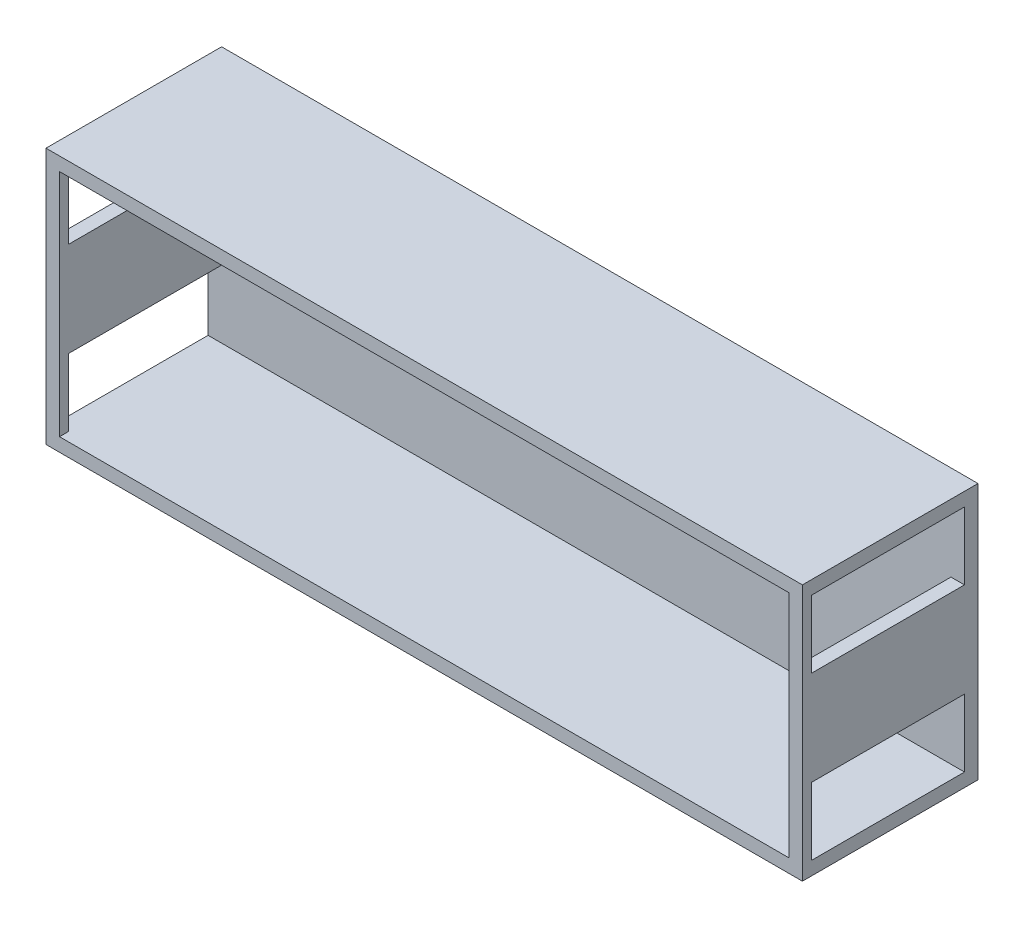
from build123d import *

# Parameters (mm, degrees)
SKETCH1_W           = 112
SKETCH1_H           = 38
BOSS_EXTRUDE1_DEPTH = 26
SHELL1_T            = -2
CUT_EXTRUDE1_DEPTH  = 1
SKETCH5_W           = 22.652499907
SKETCH5_H           = 10
CUT_EXTRUDE2_DEPTH  = 122.09500414
SKETCH6_R           = 1.5
CUT_EXTRUDE3_DEPTH  = 10


with BuildPart() as part:
    # Sketch1 → Boss-Extrude1 (new body)
    with BuildSketch(Plane.XY):
        with Locations((56, 19)):
            Rectangle(SKETCH1_W, SKETCH1_H)
    extrude(amount=BOSS_EXTRUDE1_DEPTH)

    # Shell1
    shell1_openings = [part.faces().sort_by_distance(p)[0] for p in [
        (56, 19, 26),
    ]]
    offset(amount=SHELL1_T, openings=shell1_openings, kind=Kind.INTERSECTION)

    # Sketch4 → Cut-Extrude1 (cut)
    # profile 1 of 8: a face of its own
    with BuildSketch(Plane.XZ):
        with BuildLine():
            add(Edge.make_bspline(
                [(7.650412266, 15.288091295), (7.58962305, 15.288027952), (7.470441275, 15.287903763), (7.295133908, 15.283417738), (7.126224621, 15.278936587), (6.964177459, 15.267429724), (6.808265094, 15.255788808), (6.659070989, 15.239634041), (6.516304896, 15.219523698), (6.380137163, 15.196749021), (6.250194784, 15.171262045), (6.127037021, 15.141896535), (6.010295193, 15.109234566), (5.8997942, 15.07459062), (5.796142209, 15.035264488), (5.698584225, 14.993778932), (5.608240355, 14.947860098), (5.496931644, 14.883918998), (5.371061502, 14.792494742), (5.236991325, 14.666417522), (5.127532685, 14.519509159), (5.036903395, 14.356750097), (4.967312846, 14.176767364), (4.920492006, 13.978901144), (4.892406671, 13.764481263), (4.891236718, 13.615585667), (4.890632732, 13.538718515)],
                knots=[0, 0, 0, 0, 1.163776932, 2.281671148, 3.357400293, 4.398214247, 5.391432629, 6.35063689, 7.270633997, 8.151375154, 8.993571714, 9.805342045, 10.574618554, 11.314185751, 12.021548457, 12.696290651, 13.342801888, 13.96059852, 15.152511344, 16.312453312, 17.470182576, 18.644806038, 19.869798433, 21.151486241, 22.529458571, 24, 24, 24, 24], degree=3))
            Line((4.890632732, 13.538718515), (4.891487848, 12.406898322))
            add(Edge.make_bspline(
                [(4.891487848, 12.406898322), (4.891694054, 12.330706015), (4.892092687, 12.18341258), (4.920844625, 11.971054949), (4.966807258, 11.775119354), (5.037733652, 11.596999755), (5.126848578, 11.434964436), (5.237699287, 11.289724769), (5.370960738, 11.16366211), (5.496960154, 11.072365564), (5.608208387, 11.008309855), (5.698818664, 10.962677467), (5.795894884, 10.9197799), (5.899810758, 10.880707103), (6.010453722, 10.846309606), (6.126859435, 10.812123653), (6.250221556, 10.783170308), (6.380129027, 10.757552155), (6.516309187, 10.73484697), (6.659061948, 10.71458921), (6.808324675, 10.698979528), (6.964078386, 10.68518287), (7.126298655, 10.676180173), (7.295100471, 10.669535163), (7.470256996, 10.665370067), (7.589247441, 10.665948497), (7.649846216, 10.666243076)],
                knots=[0, 0, 0, 0, 1.461116279, 2.824600596, 4.103749251, 5.314955656, 6.49267372, 7.643763169, 8.806761061, 10.001814036, 10.621238284, 11.269452785, 11.948407875, 12.657634162, 13.399149785, 14.172110185, 14.986019164, 15.830434532, 16.713496044, 17.635916927, 18.597648258, 19.593985991, 20.637168773, 21.715955473, 22.836794836, 24, 24, 24, 24], degree=3))
            Line((7.649846216, 10.666243076), (11.641207291, 10.666243076))
            add(Edge.make_bspline(
                [(11.641207291, 10.666243076), (11.688947383, 10.666304114), (11.781543412, 10.666422502), (11.916486689, 10.676044615), (12.042624809, 10.69317153), (12.160690428, 10.716187156), (12.269323443, 10.749014058), (12.369508728, 10.787637785), (12.46141843, 10.833578649), (12.544094165, 10.887857853), (12.619159072, 10.949733512), (12.681970332, 11.023656267), (12.736953332, 11.105620986), (12.780564817, 11.198234478), (12.814756871, 11.299822633), (12.839509693, 11.410801348), (12.853340204, 11.53170153), (12.855775747, 11.615451459), (12.857040757, 11.65895079)],
                knots=[0, 0, 0, 0, 1.267187071, 2.457818685, 3.588295928, 4.645513128, 5.647536173, 6.596988635, 7.493518143, 8.369595162, 9.218359999, 10.066204857, 10.935248591, 11.831896794, 12.774825794, 13.776140545, 14.844937542, 16, 16, 16, 16], degree=3))
            Line((12.857040757, 11.65895079), (12.857991609, 13.205280958))
            add(Edge.make_bspline(
                [(12.857991609, 13.205280958), (12.85669765, 13.220392688), (12.854228646, 13.249227392), (12.84085112, 13.289970659), (12.817015477, 13.324491074), (12.783340828, 13.352536177), (12.740765803, 13.37436985), (12.68905103, 13.389068008), (12.628969951, 13.398663695), (12.585826108, 13.399379023), (12.562940389, 13.39975847)],
                knots=[0, 0, 0, 0, 0.91086014, 1.738013083, 2.548247224, 3.40143125, 4.349330424, 5.406315663, 6.624176116, 8, 8, 8, 8], degree=3))
            Line((12.562940389, 13.39975847), (8.450792341, 13.39975847))
            add(Edge.make_bspline(
                [(8.450792341, 13.39975847), (8.434082987, 13.399241735), (8.402544097, 13.398266398), (8.358735061, 13.390329833), (8.320937609, 13.379882117), (8.290248339, 13.362688171), (8.264756548, 13.342279641), (8.247093228, 13.315217722), (8.236644902, 13.284036864), (8.234433339, 13.261829342), (8.233288047, 13.250328833)],
                knots=[0, 0, 0, 0, 1.348295524, 2.54490636, 3.590665824, 4.496773253, 5.369651517, 6.20129822, 7.068514512, 8, 8, 8, 8], degree=3))
            Line((8.233288047, 13.250328833), (8.23340516, 12.764557964))
            add(Edge.make_bspline(
                [(8.23340516, 12.764557964), (8.23448275, 12.752856672), (8.236547368, 12.730437457), (8.247102263, 12.699080903), (8.264754041, 12.672017563), (8.290249053, 12.65160942), (8.320937371, 12.634415397), (8.358735192, 12.623967546), (8.402380415, 12.616061355), (8.43375165, 12.615064629), (8.450294144, 12.614539041)],
                knots=[0, 0, 0, 0, 0.946557974, 1.813567813, 2.645016531, 3.517686994, 4.423578712, 5.469089218, 6.665415184, 8, 8, 8, 8], degree=3))
            Line((8.450294144, 12.614539041), (11.345994343, 12.615489893))
            add(Edge.make_bspline(
                [(11.345994343, 12.615489893), (11.364058618, 12.614597182), (11.395917351, 12.613022768), (11.437715521, 12.598115161), (11.463658055, 12.56650551), (11.463641877, 12.541405949), (11.463633189, 12.527926959)],
                knots=[0, 0, 0, 0, 1.28411838, 2.264712279, 3.068114142, 4, 4, 4, 4], degree=3))
            Line((11.463633189, 12.527926959), (11.464583111, 11.982888195))
            add(Edge.make_bspline(
                [(11.464583111, 11.982888195), (11.463260355, 11.948060486), (11.460781803, 11.882801022), (11.439257969, 11.792848769), (11.403105711, 11.717680272), (11.347815418, 11.659953773), (11.27626772, 11.618700583), (11.188778586, 11.590575416), (11.084824088, 11.573943415), (11.009700877, 11.572896652), (10.969658784, 11.572338708)],
                knots=[0, 0, 0, 0, 1.119054624, 2.096862088, 2.955002416, 3.770825078, 4.626777509, 5.585379292, 6.712961496, 8, 8, 8, 8], degree=3))
            Line((10.969658784, 11.572338708), (7.709699679, 11.572338708))
            add(Edge.make_bspline(
                [(7.709699679, 11.572338708), (7.649449163, 11.572148763), (7.533614139, 11.571783582), (7.367221575, 11.579343292), (7.215342167, 11.593285125), (7.077925059, 11.613782509), (6.955159878, 11.641202203), (6.846108253, 11.674005187), (6.751624066, 11.714447806), (6.670300335, 11.762776449), (6.60134501, 11.820029391), (6.542703307, 11.886531688), (6.493261008, 11.96303458), (6.454786739, 12.050256169), (6.425224385, 12.147102963), (6.405946865, 12.253777255), (6.393841666, 12.370288125), (6.394865773, 12.451435719), (6.395398692, 12.493662838)],
                knots=[0, 0, 0, 0, 1.535799746, 2.952661839, 4.244349141, 5.422521697, 6.491900991, 7.448670105, 8.321639816, 9.105332662, 9.851965312, 10.596843653, 11.357365104, 12.164617757, 13.019108224, 13.932791304, 14.924277806, 16, 16, 16, 16], degree=3))
            Line((6.395398692, 12.493662838), (6.395495358, 13.434590499))
            add(Edge.make_bspline(
                [(6.395495358, 13.434590499), (6.394920811, 13.477897545), (6.393813149, 13.561388803), (6.406090107, 13.681795489), (6.425018606, 13.792309302), (6.454573646, 13.892380093), (6.493540638, 13.981855398), (6.54238541, 14.060898822), (6.601021563, 14.129471857), (6.670301022, 14.187621619), (6.751294106, 14.237332305), (6.846509859, 14.276907586), (6.954731187, 14.312875176), (7.077999787, 14.339372405), (7.215319169, 14.360168863), (7.367228627, 14.374018125), (7.533331257, 14.381595678), (7.64888651, 14.381233021), (7.708856646, 14.381044811)],
                knots=[0, 0, 0, 0, 1.091148807, 2.103615804, 3.046612451, 3.914706856, 4.727724144, 5.500180658, 6.2489555, 6.992542216, 7.771802829, 8.635203899, 9.586342064, 10.643999867, 11.809258447, 13.086787535, 14.48811937, 16, 16, 16, 16], degree=3))
            Line((7.708856646, 14.381044811), (12.651890098, 14.381994733))
            add(Edge.make_bspline(
                [(12.651890098, 14.381994733), (12.668891274, 14.382263309), (12.700656115, 14.382765112), (12.745260968, 14.388888297), (12.782688516, 14.401476764), (12.813870398, 14.417505904), (12.838796853, 14.437887615), (12.856705043, 14.463410175), (12.866290249, 14.494292366), (12.867089869, 14.516133779), (12.86751035, 14.527619105)],
                knots=[0, 0, 0, 0, 1.380846807, 2.579961532, 3.639398536, 4.573220638, 5.414635905, 6.229587447, 7.069027095, 8, 8, 8, 8], degree=3))
            Line((12.86751035, 14.527619105), (12.867821723, 15.148677667))
            add(Edge.make_bspline(
                [(12.867821723, 15.148677667), (12.867251449, 15.159670964), (12.866160538, 15.180700681), (12.856757768, 15.210623989), (12.838398219, 15.235009903), (12.81437186, 15.255749712), (12.782252971, 15.269174949), (12.745239318, 15.281337619), (12.700416575, 15.286058798), (12.668584213, 15.286762044), (12.651456034, 15.287140443)],
                knots=[0, 0, 0, 0, 0.904708645, 1.730669813, 2.535293356, 3.388075762, 4.311158966, 5.37693696, 6.588596938, 8, 8, 8, 8], degree=3))
            Line((12.651456034, 15.287140443), (7.650412266, 15.288091295))
        make_face()
    # profile 2 of 8: a face of its own
    with BuildSketch(Plane.XZ):
        with BuildLine():
            add(Edge.make_bspline(
                [(18.678840525, 15.285691394), (18.655399701, 15.285149581), (18.611704527, 15.284139609), (18.551093449, 15.274515757), (18.499558011, 15.260084824), (18.457496636, 15.237777713), (18.424163404, 15.209694213), (18.398919253, 15.175542023), (18.385720767, 15.133522079), (18.383992268, 15.103846468), (18.383081976, 15.088218188)],
                knots=[0, 0, 0, 0, 1.396314113, 2.602817601, 3.649946093, 4.572285283, 5.417513077, 6.231037511, 7.068398594, 8, 8, 8, 8], degree=3))
            Line((18.383081976, 15.088218188), (18.383937091, 10.81177357))
            add(Edge.make_bspline(
                [(18.383937091, 10.81177357), (18.384153022, 10.799919519), (18.384562775, 10.777425163), (18.397360392, 10.746682574), (18.415221286, 10.720178391), (18.441641181, 10.699964008), (18.473708353, 10.68338281), (18.513215691, 10.67259688), (18.559248331, 10.665965006), (18.592128973, 10.665525111), (18.609605884, 10.665291295)],
                knots=[0, 0, 0, 0, 0.925554576, 1.756340758, 2.581468853, 3.416753911, 4.344507695, 5.412183891, 6.62450897, 8, 8, 8, 8], degree=3))
            Line((18.609605884, 10.665291295), (19.671682083, 10.666242146))
            add(Edge.make_bspline(
                [(19.671682083, 10.666242146), (19.688559663, 10.666094342), (19.720533176, 10.665814334), (19.76508229, 10.672462767), (19.803214748, 10.683574257), (19.834144232, 10.69994129), (19.859490348, 10.720285959), (19.876777164, 10.746577871), (19.886680498, 10.777551015), (19.887445604, 10.799416057), (19.887847936, 10.810913807)],
                knots=[0, 0, 0, 0, 1.364485568, 2.584932061, 3.632938362, 4.563594268, 5.402156653, 6.235590167, 7.07218363, 8, 8, 8, 8], degree=3))
            Line((19.887847936, 10.810913807), (19.887944601, 12.128177956))
            Line((19.887944601, 12.128177956), (23.083486528, 12.128177956))
            Line((23.083486528, 12.128177956), (24.646313925, 10.752237988))
            add(Edge.make_bspline(
                [(24.646313925, 10.752237988), (24.660385373, 10.738226497), (24.688419345, 10.710311974), (24.734716511, 10.688077136), (24.777467318, 10.674987977), (24.818687187, 10.670895032), (24.867092817, 10.664985543), (24.902119766, 10.665184703), (24.920866531, 10.665291295)],
                knots=[0, 0, 0, 0, 1.192208263, 2.375187891, 3.054495688, 3.8866952, 4.868938648, 6, 6, 6, 6], degree=3))
            Line((24.920866531, 10.665291295), (26.189641893, 10.666242146))
            add(Edge.make_bspline(
                [(26.189641893, 10.666242146), (26.209117497, 10.667330834), (26.244188845, 10.669291325), (26.289696232, 10.682643161), (26.324576289, 10.701052169), (26.343432984, 10.729462951), (26.34925161, 10.758140392), (26.34971034, 10.785909818), (26.336615565, 10.810614476), (26.32382612, 10.823929392), (26.317129443, 10.830901211)],
                knots=[0, 0, 0, 0, 1.639971042, 2.953232935, 3.986567962, 4.892710556, 5.717659192, 6.441187008, 7.183790474, 8, 8, 8, 8], degree=3))
            Line((26.317129443, 10.830901211), (24.636483811, 12.231029804))
            add(Edge.make_bspline(
                [(24.636483811, 12.231029804), (24.698370929, 12.239310878), (24.818544656, 12.255391245), (24.991507881, 12.288294722), (25.151407133, 12.329298624), (25.298308906, 12.37728087), (25.4320383, 12.433858088), (25.553550432, 12.495803823), (25.661228636, 12.566947618), (25.755959721, 12.645186007), (25.839118665, 12.730963032), (25.910396049, 12.824387144), (25.971326392, 12.925312362), (26.019599195, 13.034186905), (26.056744335, 13.150427399), (26.083468579, 13.273722354), (26.098659228, 13.404765994), (26.100256368, 13.494579846), (26.101075127, 13.540622077)],
                knots=[0, 0, 0, 0, 1.362244052, 2.645234568, 3.839009007, 4.962021499, 6.013725939, 7.00452225, 7.933796259, 8.823687908, 9.680436211, 10.534719853, 11.382386607, 12.246930273, 13.126993649, 14.040797093, 14.995632972, 16, 16, 16, 16], degree=3))
            Line((26.101075127, 13.540622077), (26.101170863, 13.9226897))
            add(Edge.make_bspline(
                [(26.101170863, 13.9226897), (26.100430235, 13.976879009), (26.098983912, 14.082701694), (26.076827478, 14.236599124), (26.038646653, 14.38028045), (25.985589093, 14.514317773), (25.914228925, 14.636835567), (25.827555083, 14.749123664), (25.725882379, 14.852217711), (25.606454341, 14.94370569), (25.470064795, 15.025445903), (25.313956379, 15.094284497), (25.139590075, 15.154206534), (24.945571933, 15.202270367), (24.732311213, 15.238454135), (24.50015294, 15.266148687), (24.248176544, 15.281968495), (24.073803319, 15.28412064), (23.983362122, 15.285236881)],
                knots=[0, 0, 0, 0, 0.907580553, 1.772353468, 2.597816755, 3.394645716, 4.180811829, 4.965700193, 5.766563936, 6.600410544, 7.480399717, 8.425215557, 9.45432493, 10.567275478, 11.771025134, 13.077572041, 14.484240418, 16, 16, 16, 16], degree=3))
            Line((23.983362122, 15.285236881), (18.678840525, 15.285691394))
        make_face()
        with BuildLine():
            add(Edge.make_bspline(
                [(19.887944601, 14.304039769), (19.888666307, 14.316355909), (19.890081345, 14.340503993), (19.919839617, 14.368334187), (19.963377268, 14.382311261), (19.997163679, 14.383324892), (20.016338388, 14.383900155)],
                knots=[0, 0, 0, 0, 0.835721651, 1.638587814, 2.659834257, 4, 4, 4, 4], degree=3))
            Line((20.016338388, 14.383900155), (23.677085647, 14.384393705))
            add(Edge.make_bspline(
                [(23.677085647, 14.384393705), (23.717011423, 14.384037169), (23.794151399, 14.383348312), (23.905503996, 14.375180844), (24.008205119, 14.364425233), (24.10206034, 14.348384965), (24.186560962, 14.327413647), (24.262897129, 14.303334827), (24.32949458, 14.272444471), (24.388525338, 14.238558735), (24.439056569, 14.198388261), (24.482745195, 14.154074017), (24.519385195, 14.104671925), (24.549708086, 14.050901458), (24.570616989, 13.991374206), (24.587701462, 13.927907807), (24.595767978, 13.85936272), (24.596125987, 13.81221098), (24.596309167, 13.78808517)],
                knots=[0, 0, 0, 0, 1.529324446, 2.954784193, 4.275606542, 5.484589672, 6.598948596, 7.609864721, 8.545407738, 9.406358445, 10.211256791, 11.010629455, 11.783693543, 12.561710779, 13.365507028, 14.193924206, 15.075897478, 16, 16, 16, 16], degree=3))
            Line((24.596309167, 13.78808517), (24.597163353, 13.50788787))
            add(Edge.make_bspline(
                [(24.597163353, 13.50788787), (24.596623991, 13.483571646), (24.595574126, 13.436240257), (24.587754603, 13.367485397), (24.570603573, 13.304021131), (24.549711509, 13.244493339), (24.519384297, 13.190723011), (24.482745444, 13.141320878), (24.4390565, 13.09700666), (24.388525361, 13.056836122), (24.32949456, 13.022950641), (24.26289719, 12.992059215), (24.18656071, 12.967984919), (24.102061424, 12.946994215), (24.008200532, 12.931036236), (23.905543649, 12.919933741), (23.794048068, 12.913224159), (23.716873201, 12.912711924), (23.676888599, 12.912446534)],
                knots=[0, 0, 0, 0, 0.93128724, 1.812745157, 2.640678272, 3.444004845, 4.221567469, 4.99417984, 5.793085413, 6.59751344, 7.457961075, 8.392957433, 9.403282859, 10.516990639, 11.725267334, 13.045317898, 14.469167606, 16, 16, 16, 16], degree=3))
            Line((23.676888599, 12.912446534), (19.887944601, 12.912446534))
            Line((19.887944601, 12.912446534), (19.887944601, 14.304039769))
        make_face(mode=Mode.SUBTRACT)
    # profile 3 of 8: a face of its own
    with BuildSketch(Plane.XZ):
        with BuildLine():
            add(Edge.make_bspline(
                [(34.330504707, 15.288091295), (34.269795603, 15.287992272), (34.1506953, 15.287798007), (33.975435094, 15.283808487), (33.806585585, 15.277548223), (33.644446559, 15.266925073), (33.488647852, 15.2535353), (33.339392611, 15.237818866), (33.196634425, 15.217600147), (33.060467996, 15.194842749), (32.930513777, 15.16938618), (32.807399369, 15.139891172), (32.690412406, 15.107658708), (32.580349701, 15.071381187), (32.47619362, 15.032746479), (32.379154543, 14.98973068), (32.288535425, 14.944127486), (32.177288039, 14.880063872), (32.05130147, 14.788764165), (31.917983644, 14.662729632), (31.807510378, 14.517603376), (31.71753243, 14.356000921), (31.647571171, 14.177793551), (31.6010339, 13.982373664), (31.572687253, 13.771168556), (31.571549106, 13.624791254), (31.570961259, 13.549188107)],
                knots=[0, 0, 0, 0, 1.166301267, 2.288072551, 3.367756207, 4.412179899, 5.409346036, 6.371876997, 7.295064826, 8.178860559, 9.023978014, 9.838563717, 10.610508221, 11.354515239, 12.064331212, 12.743850818, 13.392604277, 14.012543543, 15.208590144, 16.372555009, 17.524601529, 18.69797592, 19.915861141, 21.190154245, 22.548728665, 24, 24, 24, 24], degree=3))
            Line((31.570961259, 13.549188107), (31.571816375, 12.404566272))
            add(Edge.make_bspline(
                [(31.571816375, 12.404566272), (31.572035688, 12.328837097), (31.572459991, 12.182324238), (31.601085314, 11.971011241), (31.647558413, 11.775589624), (31.717535648, 11.597382685), (31.807509547, 11.435780121), (31.917983867, 11.290653894), (32.051301406, 11.164619353), (32.177288048, 11.073319647), (32.288535424, 11.009256033), (32.379154543, 10.96365284), (32.47619362, 10.92063704), (32.580349701, 10.882002332), (32.690412406, 10.845724811), (32.807399369, 10.813492348), (32.930513777, 10.783997335), (33.060467996, 10.758540786), (33.196634425, 10.735783308), (33.339392612, 10.715564906), (33.488647849, 10.699847217), (33.644446569, 10.686462409), (33.806585544, 10.675819522), (33.975435257, 10.669637023), (34.150583863, 10.665343056), (34.269575408, 10.665939382), (34.330174743, 10.666243076)],
                knots=[0, 0, 0, 0, 1.453489124, 2.812058191, 4.086346275, 5.304226698, 6.477596465, 7.629638447, 8.793598726, 9.989640614, 10.609577438, 11.258328341, 11.93784527, 12.647658446, 13.391662533, 14.163603996, 14.978186489, 15.823300615, 16.707092865, 17.630277057, 18.592804226, 19.589966434, 20.634386011, 21.714065414, 22.835832277, 24, 24, 24, 24], degree=3))
            Line((34.330174743, 10.666243076), (37.383232061, 10.666243076))
            add(Edge.make_bspline(
                [(37.383232061, 10.666243076), (37.443916925, 10.665940417), (37.563311212, 10.66534495), (37.739179096, 10.669646001), (37.908666105, 10.675780487), (38.071433056, 10.686517417), (38.227558042, 10.699791423), (38.37712781, 10.715556638), (38.520186156, 10.735878376), (38.656695915, 10.758462256), (38.786679024, 10.783839001), (38.909674345, 10.813801788), (39.026780591, 10.845566798), (39.136879971, 10.881807494), (39.240557999, 10.92085714), (39.337375925, 10.963624492), (39.42797296, 11.009274617), (39.539048567, 11.073126311), (39.664322343, 11.164640949), (39.796666342, 11.29094966), (39.907058154, 11.435777458), (39.997329816, 11.597173785), (40.065730586, 11.775832155), (40.113023323, 11.970895018), (40.1396552, 12.182309726), (40.14103661, 12.328610712), (40.141750299, 12.404195412)],
                knots=[0, 0, 0, 0, 1.165538185, 2.29313524, 3.378651364, 4.422826939, 5.425827663, 6.388129961, 7.311098474, 8.200694464, 9.045611151, 9.854077078, 10.631709921, 11.375540189, 12.079487253, 12.75884543, 13.407444769, 14.02723676, 15.218067004, 16.377359446, 17.529132282, 18.702227921, 19.917610767, 21.191601146, 22.549073435, 24, 24, 24, 24], degree=3))
            Line((40.141750299, 12.404195412), (40.141845106, 13.549711401))
            add(Edge.make_bspline(
                [(40.141845106, 13.549711401), (40.141084663, 13.625121114), (40.139611121, 13.771245736), (40.11302876, 13.982488635), (40.065729239, 14.177551331), (39.997330156, 14.356209743), (39.907058066, 14.517606059), (39.796666365, 14.66243386), (39.664322336, 14.78874257), (39.539048568, 14.880257208), (39.42797296, 14.944108902), (39.337375925, 14.989759027), (39.240557999, 15.032526379), (39.136879971, 15.071576025), (39.026780591, 15.107816721), (38.909674345, 15.139581731), (38.786679024, 15.169544518), (38.656695915, 15.194921263), (38.520186156, 15.217505142), (38.37712781, 15.237826883), (38.227558042, 15.253592089), (38.071433056, 15.266866131), (37.908666104, 15.277602918), (37.7391791, 15.283737972), (37.563079497, 15.288042442), (37.443453442, 15.287444785), (37.382536815, 15.287140443)],
                knots=[0, 0, 0, 0, 1.447528114, 2.804937036, 4.078867945, 5.294194056, 6.467234935, 7.618954006, 8.778192332, 9.968966988, 10.588730047, 11.237299109, 11.916625573, 12.620539777, 13.364335323, 14.141931866, 14.950360054, 15.795237299, 16.684791763, 17.607717192, 18.56997457, 19.572928473, 20.617055306, 21.702520758, 22.830065176, 24, 24, 24, 24], degree=3))
            Line((37.382536815, 15.287140443), (34.330504707, 15.288091295))
        make_face()
        with BuildLine():
            add(Edge.make_bspline(
                [(33.075823884, 13.476475375), (33.075259335, 13.517559637), (33.074168634, 13.596933822), (33.086364325, 13.71134668), (33.105472242, 13.81645308), (33.134796906, 13.911584102), (33.174388684, 13.996631313), (33.222728202, 14.072457766), (33.281452, 14.138194202), (33.35103124, 14.193345999), (33.431935885, 14.241016719), (33.52686498, 14.279773233), (33.635114844, 14.314798089), (33.758456296, 14.339981311), (33.895574369, 14.361513011), (34.04762599, 14.373609431), (34.21364843, 14.381711937), (34.329211158, 14.381272742), (34.389185173, 14.381044811)],
                knots=[0, 0, 0, 0, 1.054582134, 2.037437011, 2.950106534, 3.795568272, 4.586771669, 5.353113831, 6.097606858, 6.839642437, 7.625158954, 8.501595105, 9.468129542, 10.543935283, 11.731125076, 13.031958262, 14.45966442, 16, 16, 16, 16], degree=3))
            Line((34.389185173, 14.381044811), (37.323955802, 14.381994733))
            add(Edge.make_bspline(
                [(37.323955802, 14.381994733), (37.383785938, 14.381815958), (37.499201781, 14.381471091), (37.665085998, 14.373664366), (37.817137088, 14.361500199), (37.954255286, 14.339984278), (38.077596709, 14.31479741), (38.185846579, 14.279773389), (38.280775673, 14.241016683), (38.361680321, 14.193346007), (38.431259551, 14.138194199), (38.489983382, 14.072457766), (38.538322774, 13.996631312), (38.577915049, 13.911584108), (38.607237668, 13.816453058), (38.626354134, 13.711346773), (38.638534468, 13.596742449), (38.637513817, 13.517176847), (38.636984339, 13.47590096)],
                knots=[0, 0, 0, 0, 1.53659731, 2.964186387, 4.264912895, 5.452005331, 6.527722849, 7.494178024, 8.370542301, 9.1559944, 9.897969127, 10.642401101, 11.408680417, 12.199818931, 13.045211336, 13.957806013, 14.94058029, 16, 16, 16, 16], degree=3))
            Line((38.636984339, 13.47590096), (38.637837596, 12.477802298))
            add(Edge.make_bspline(
                [(38.637837596, 12.477802298), (38.638006992, 12.436420586), (38.638333113, 12.356752854), (38.626405077, 12.242036158), (38.607225501, 12.136930602), (38.577917982, 12.041799378), (38.538322037, 11.956752216), (38.489983571, 11.880925751), (38.431259502, 11.815189318), (38.361680335, 11.76003752), (38.280775668, 11.712366801), (38.18584658, 11.673610286), (38.077596714, 11.638585431), (37.954255262, 11.613402208), (37.817137189, 11.591870508), (37.665085568, 11.579774088), (37.499063128, 11.571671582), (37.383500401, 11.572110777), (37.323526385, 11.572338708)],
                knots=[0, 0, 0, 0, 1.061811644, 2.044191088, 2.956419127, 3.801471892, 4.592292563, 5.358264023, 6.102396919, 6.844073555, 7.629210096, 8.50522229, 9.471289188, 10.546574532, 11.733190049, 13.033393985, 14.460409523, 16, 16, 16, 16], degree=3))
            Line((37.323526385, 11.572338708), (34.389780966, 11.572338708))
            add(Edge.make_bspline(
                [(34.389780966, 11.572338708), (34.329608295, 11.572107877), (34.213846889, 11.5716638), (34.047625978, 11.579773643), (33.895574372, 11.591870611), (33.758456295, 11.613402184), (33.635114844, 11.638585436), (33.52686498, 11.673610285), (33.431935885, 11.712366801), (33.351031238, 11.76003752), (33.281452007, 11.815189317), (33.222728176, 11.880925753), (33.174388784, 11.956752207), (33.134796509, 12.041799412), (33.10547389, 12.136930462), (33.086357424, 12.242036746), (33.07417709, 12.35664107), (33.075197741, 12.436206672), (33.075727219, 12.477482559)],
                knots=[0, 0, 0, 0, 1.544469297, 2.971281381, 4.271299944, 5.457746281, 6.532878319, 7.498807482, 8.374694781, 9.159719383, 9.901290276, 10.645317078, 11.411179332, 12.201887253, 13.046819537, 13.958917517, 14.9411569, 16, 16, 16, 16], degree=3))
            Line((33.075727219, 12.477482559), (33.075823884, 13.476475375))
        make_face(mode=Mode.SUBTRACT)
    # profile 4 of 8: a face of its own
    with BuildSketch(Plane.XZ):
        with BuildLine():
            add(Edge.make_bspline(
                [(48.371179879, 15.288091295), (48.310470775, 15.287992272), (48.191370472, 15.287798007), (48.016110266, 15.283808487), (47.847260758, 15.277548223), (47.685121731, 15.266925073), (47.529323024, 15.2535353), (47.380067783, 15.237818866), (47.237309598, 15.217600147), (47.101143168, 15.194842749), (46.97118895, 15.16938618), (46.848074541, 15.139891172), (46.731087579, 15.107658708), (46.621024874, 15.071381187), (46.516868792, 15.032746479), (46.419829715, 14.98973068), (46.329210598, 14.944127486), (46.217963212, 14.880063872), (46.091976642, 14.788764165), (45.958658816, 14.662729632), (45.848185551, 14.517603376), (45.758207602, 14.356000921), (45.688246344, 14.177793551), (45.641709073, 13.982373664), (45.613362425, 13.771168556), (45.612224278, 13.624791254), (45.611636431, 13.549188107)],
                knots=[0, 0, 0, 0, 1.166301267, 2.288072551, 3.367756207, 4.412179899, 5.409346036, 6.371876997, 7.295064826, 8.178860559, 9.023978014, 9.838563717, 10.610508221, 11.354515239, 12.064331212, 12.743850818, 13.392604277, 14.012543543, 15.208590144, 16.372555009, 17.524601529, 18.69797592, 19.915861141, 21.190154245, 22.548728665, 24, 24, 24, 24], degree=3))
            Line((45.611636431, 13.549188107), (45.612491547, 12.404566272))
            add(Edge.make_bspline(
                [(45.612491547, 12.404566272), (45.61271086, 12.328837097), (45.613135163, 12.182324238), (45.641760486, 11.971011241), (45.688233586, 11.775589624), (45.758210821, 11.597382685), (45.848184719, 11.435780121), (45.95865904, 11.290653894), (46.091976579, 11.164619353), (46.21796322, 11.073319647), (46.329210596, 11.009256033), (46.419829716, 10.96365284), (46.516868792, 10.92063704), (46.621024874, 10.882002332), (46.731087579, 10.845724811), (46.848074541, 10.813492348), (46.97118895, 10.783997335), (47.101143168, 10.758540786), (47.237309597, 10.735783308), (47.380067784, 10.715564906), (47.529323021, 10.699847217), (47.685121742, 10.686462409), (47.847260716, 10.675819522), (48.016110429, 10.669637023), (48.191259035, 10.665343056), (48.31025058, 10.665939382), (48.370849916, 10.666243076)],
                knots=[0, 0, 0, 0, 1.453489124, 2.812058191, 4.086346275, 5.304226698, 6.477596465, 7.629638447, 8.793598726, 9.989640614, 10.609577438, 11.258328341, 11.93784527, 12.647658446, 13.391662533, 14.163603996, 14.978186489, 15.823300615, 16.707092865, 17.630277057, 18.592804226, 19.589966434, 20.634386011, 21.714065414, 22.835832277, 24, 24, 24, 24], degree=3))
            Line((48.370849916, 10.666243076), (51.423907233, 10.666243076))
            add(Edge.make_bspline(
                [(51.423907233, 10.666243076), (51.484592098, 10.665940417), (51.603986384, 10.66534495), (51.779854268, 10.669646001), (51.949341277, 10.675780487), (52.112108228, 10.686517417), (52.268233214, 10.699791423), (52.417802982, 10.715556638), (52.560861328, 10.735878376), (52.697371087, 10.758462256), (52.827354196, 10.783839001), (52.950349518, 10.813801788), (53.067455763, 10.845566798), (53.177555143, 10.881807494), (53.281233171, 10.92085714), (53.378051098, 10.963624492), (53.468648132, 11.009274617), (53.579723739, 11.073126311), (53.704997515, 11.164640949), (53.837341514, 11.29094966), (53.947733327, 11.435777458), (54.038004988, 11.597173785), (54.106405758, 11.775832155), (54.153698496, 11.970895018), (54.180330372, 12.182309726), (54.181711782, 12.328610712), (54.182425472, 12.404195412)],
                knots=[0, 0, 0, 0, 1.165538185, 2.29313524, 3.378651364, 4.422826939, 5.425827663, 6.388129961, 7.311098474, 8.200694464, 9.045611151, 9.854077078, 10.631709921, 11.375540189, 12.079487253, 12.75884543, 13.407444769, 14.02723676, 15.218067004, 16.377359446, 17.529132282, 18.702227921, 19.917610767, 21.191601146, 22.549073435, 24, 24, 24, 24], degree=3))
            Line((54.182425472, 12.404195412), (54.182520278, 13.549711401))
            add(Edge.make_bspline(
                [(54.182520278, 13.549711401), (54.181759835, 13.625121114), (54.180286293, 13.771245736), (54.153703932, 13.982488635), (54.106404412, 14.177551331), (54.038005328, 14.356209743), (53.947733239, 14.517606059), (53.837341538, 14.66243386), (53.704997508, 14.78874257), (53.57972374, 14.880257208), (53.468648132, 14.944108902), (53.378051098, 14.989759027), (53.281233171, 15.032526379), (53.177555143, 15.071576025), (53.067455763, 15.107816721), (52.950349518, 15.139581731), (52.827354196, 15.169544518), (52.697371087, 15.194921263), (52.560861328, 15.217505142), (52.417802982, 15.237826883), (52.268233214, 15.253592089), (52.112108228, 15.266866131), (51.949341276, 15.277602918), (51.779854272, 15.283737972), (51.603754669, 15.288042442), (51.484128614, 15.287444785), (51.423211987, 15.287140443)],
                knots=[0, 0, 0, 0, 1.447528114, 2.804937036, 4.078867945, 5.294194056, 6.467234935, 7.618954006, 8.778192332, 9.968966988, 10.588730047, 11.237299109, 11.916625573, 12.620539777, 13.364335323, 14.141931866, 14.950360054, 15.795237299, 16.684791763, 17.607717192, 18.56997457, 19.572928473, 20.617055306, 21.702520758, 22.830065176, 24, 24, 24, 24], degree=3))
            Line((51.423211987, 15.287140443), (48.371179879, 15.288091295))
        make_face()
        with BuildLine():
            add(Edge.make_bspline(
                [(47.116499057, 13.476475375), (47.115934507, 13.517559637), (47.114843806, 13.596933822), (47.127039497, 13.71134668), (47.146147414, 13.81645308), (47.175472078, 13.911584102), (47.215063856, 13.996631313), (47.263403374, 14.072457766), (47.322127172, 14.138194202), (47.391706412, 14.193345999), (47.472611057, 14.241016719), (47.567540152, 14.279773233), (47.675790016, 14.314798089), (47.799131468, 14.339981311), (47.936249542, 14.361513011), (48.088301163, 14.373609431), (48.254323602, 14.381711937), (48.36988633, 14.381272742), (48.429860345, 14.381044811)],
                knots=[0, 0, 0, 0, 1.054582134, 2.037437011, 2.950106534, 3.795568272, 4.586771669, 5.353113831, 6.097606858, 6.839642437, 7.625158954, 8.501595105, 9.468129542, 10.543935283, 11.731125076, 13.031958262, 14.45966442, 16, 16, 16, 16], degree=3))
            Line((48.429860345, 14.381044811), (51.364630974, 14.381994733))
            add(Edge.make_bspline(
                [(51.364630974, 14.381994733), (51.42446111, 14.381815958), (51.539876953, 14.381471091), (51.70576117, 14.373664366), (51.857812261, 14.361500199), (51.994930458, 14.339984278), (52.118271881, 14.31479741), (52.226521752, 14.279773389), (52.321450845, 14.241016683), (52.402355493, 14.193346007), (52.471934723, 14.138194199), (52.530658554, 14.072457766), (52.578997947, 13.996631312), (52.618590221, 13.911584108), (52.64791284, 13.816453058), (52.667029306, 13.711346773), (52.67920964, 13.596742449), (52.678188989, 13.517176847), (52.677659511, 13.47590096)],
                knots=[0, 0, 0, 0, 1.53659731, 2.964186387, 4.264912895, 5.452005331, 6.527722849, 7.494178024, 8.370542301, 9.1559944, 9.897969127, 10.642401101, 11.408680417, 12.199818931, 13.045211336, 13.957806013, 14.94058029, 16, 16, 16, 16], degree=3))
            Line((52.677659511, 13.47590096), (52.678512768, 12.477802298))
            add(Edge.make_bspline(
                [(52.678512768, 12.477802298), (52.678682164, 12.436420586), (52.679008285, 12.356752854), (52.667080249, 12.242036158), (52.647900673, 12.136930602), (52.618593154, 12.041799378), (52.578997209, 11.956752216), (52.530658743, 11.880925751), (52.471934674, 11.815189318), (52.402355507, 11.76003752), (52.321450841, 11.712366801), (52.226521752, 11.673610286), (52.118271886, 11.638585431), (51.994930435, 11.613402208), (51.857812361, 11.591870508), (51.70576074, 11.579774088), (51.539738301, 11.571671582), (51.424175573, 11.572110777), (51.364201557, 11.572338708)],
                knots=[0, 0, 0, 0, 1.061811644, 2.044191088, 2.956419127, 3.801471892, 4.592292563, 5.358264023, 6.102396919, 6.844073555, 7.629210096, 8.50522229, 9.471289188, 10.546574532, 11.733190049, 13.033393985, 14.460409523, 16, 16, 16, 16], degree=3))
            Line((51.364201557, 11.572338708), (48.430456138, 11.572338708))
            add(Edge.make_bspline(
                [(48.430456138, 11.572338708), (48.370283467, 11.572107877), (48.254522061, 11.5716638), (48.08830115, 11.579773643), (47.936249545, 11.591870611), (47.799131467, 11.613402184), (47.675790016, 11.638585436), (47.567540152, 11.673610285), (47.472611058, 11.712366801), (47.39170641, 11.76003752), (47.322127179, 11.815189317), (47.263403348, 11.880925753), (47.215063956, 11.956752207), (47.175471681, 12.041799412), (47.146149062, 12.136930462), (47.127032597, 12.242036746), (47.114852263, 12.35664107), (47.115872913, 12.436206672), (47.116402391, 12.477482559)],
                knots=[0, 0, 0, 0, 1.544469297, 2.971281381, 4.271299944, 5.457746281, 6.532878319, 7.498807482, 8.374694781, 9.159719383, 9.901290276, 10.645317078, 11.411179332, 12.201887253, 13.046819537, 13.958917517, 14.9411569, 16, 16, 16, 16], degree=3))
            Line((47.116402391, 12.477482559), (47.116499057, 13.476475375))
        make_face(mode=Mode.SUBTRACT)
    # profile 5 of 8: a face of its own
    with BuildSketch(Plane.XZ):
        with BuildLine():
            add(Edge.make_bspline(
                [(59.551295466, 15.288091295), (59.533582941, 15.287286865), (59.500555511, 15.285786897), (59.454137034, 15.281538744), (59.415657004, 15.268911494), (59.382203432, 15.255985803), (59.356759339, 15.235369292), (59.338952469, 15.210206445), (59.326681436, 15.180958412), (59.325509941, 15.159416518), (59.324898896, 15.148180399)],
                knots=[0, 0, 0, 0, 1.420824711, 2.649322396, 3.709893168, 4.653656833, 5.502432656, 6.284779833, 7.105351775, 8, 8, 8, 8], degree=3))
            Line((59.324898896, 15.148180399), (59.325202834, 14.527727853))
            add(Edge.make_bspline(
                [(59.325202834, 14.527727853), (59.325677095, 14.516131621), (59.326585642, 14.493916588), (59.339014107, 14.463819866), (59.356364473, 14.437530864), (59.382685046, 14.417282025), (59.415252322, 14.401746267), (59.454108687, 14.388674315), (59.500192425, 14.383059469), (59.533017114, 14.381744187), (59.550471023, 14.381044811)],
                knots=[0, 0, 0, 0, 0.912525661, 1.748135666, 2.543053961, 3.383188962, 4.338745561, 5.396016776, 6.61538102, 8, 8, 8, 8], degree=3))
            Line((59.550471023, 14.381044811), (62.637951401, 14.381994733))
            Line((62.637951401, 14.381994733), (62.637951401, 10.813000476))
            add(Edge.make_bspline(
                [(62.637951401, 10.813000476), (62.63782245, 10.801065822), (62.637579635, 10.778592723), (62.649544999, 10.74798656), (62.665520307, 10.720949811), (62.690548005, 10.699904228), (62.722004106, 10.683416748), (62.760243682, 10.672687709), (62.80500022, 10.665892227), (62.836940808, 10.665501333), (62.854103311, 10.665291295)],
                knots=[0, 0, 0, 0, 0.949342162, 1.787623007, 2.600733942, 3.449409482, 4.372848616, 5.437112078, 6.622894103, 8, 8, 8, 8], degree=3))
            Line((62.854103311, 10.665291295), (63.925696393, 10.666242146))
            add(Edge.make_bspline(
                [(63.925696393, 10.666242146), (63.942572313, 10.6660966), (63.974542405, 10.665820874), (64.019116392, 10.672441008), (64.057172897, 10.683640108), (64.08852464, 10.699829427), (64.113209839, 10.721269743), (64.13084076, 10.747474575), (64.140776066, 10.778825441), (64.141485375, 10.801004246), (64.141863175, 10.812817369)],
                knots=[0, 0, 0, 0, 1.35732226, 2.571339312, 3.613824606, 4.539577719, 5.390379894, 6.219422793, 7.051608993, 8, 8, 8, 8], degree=3))
            Line((64.141863175, 10.812817369), (64.141958911, 14.381994733))
            Line((64.141958911, 14.381994733), (67.228614846, 14.381994733))
            add(Edge.make_bspline(
                [(67.228614846, 14.381994733), (67.246030952, 14.382289389), (67.278834015, 14.382844369), (67.324849676, 14.388722512), (67.363708067, 14.401735434), (67.396276808, 14.417284283), (67.42259095, 14.437530807), (67.439964252, 14.46381816), (67.452291161, 14.493900456), (67.453454743, 14.516062632), (67.454061494, 14.527619105)],
                knots=[0, 0, 0, 0, 1.381282458, 2.601631717, 3.659757006, 4.616085513, 5.456899184, 6.252459622, 7.088744641, 8, 8, 8, 8], degree=3))
            Line((67.454061494, 14.527619105), (67.454707478, 15.148677667))
            add(Edge.make_bspline(
                [(67.454707478, 15.148677667), (67.453805336, 15.159737691), (67.452065421, 15.181068592), (67.440047003, 15.210210963), (67.422189877, 15.235368496), (67.396760335, 15.255983897), (67.363302725, 15.268921599), (67.324821723, 15.281492524), (67.278703265, 15.2859748), (67.245931179, 15.286735557), (67.228489367, 15.287140443)],
                knots=[0, 0, 0, 0, 0.887406982, 1.711496451, 2.497197297, 3.349611547, 4.297420821, 5.362537916, 6.596301773, 8, 8, 8, 8], degree=3))
            Line((67.228489367, 15.287140443), (59.551295466, 15.288091295))
        make_face()
    # profile 6 of 8: a face of its own
    with BuildSketch(Plane.XZ):
        with BuildLine():
            add(Edge.make_bspline(
                [(72.953207459, 15.288091295), (72.929774309, 15.287326209), (72.886100678, 15.285900277), (72.825410795, 15.27654139), (72.774214716, 15.261725757), (72.731661235, 15.240761744), (72.698213174, 15.212421238), (72.673543076, 15.177584876), (72.660138074, 15.135762925), (72.658370688, 15.106391929), (72.65744891, 15.091073531)],
                knots=[0, 0, 0, 0, 1.398845247, 2.607103681, 3.655755296, 4.570654732, 5.41711197, 6.247306128, 7.085885212, 8, 8, 8, 8], degree=3))
            Line((72.65744891, 15.091073531), (72.658304026, 10.863217154))
            add(Edge.make_bspline(
                [(72.658304026, 10.863217154), (72.65882995, 10.847578564), (72.659829846, 10.817846237), (72.673652197, 10.775877097), (72.697868433, 10.740854702), (72.732274124, 10.713852014), (72.773851455, 10.69131176), (72.825485431, 10.677012656), (72.885819599, 10.667265091), (72.929292017, 10.666598797), (72.952501059, 10.666243076)],
                knots=[0, 0, 0, 0, 0.930724486, 1.769507648, 2.599903844, 3.434396527, 4.358302114, 5.40720893, 6.615761408, 8, 8, 8, 8], degree=3))
            Line((72.952501059, 10.666243076), (78.798424389, 10.666243076))
            add(Edge.make_bspline(
                [(78.798424389, 10.666243076), (78.87678665, 10.667393391), (79.027665599, 10.669608212), (79.244935658, 10.684891343), (79.444260821, 10.709036977), (79.625529579, 10.74302459), (79.789069759, 10.785773959), (79.93554669, 10.835864508), (80.06316314, 10.898012771), (80.17308559, 10.969143216), (80.267564109, 11.04794277), (80.348311839, 11.134384073), (80.416094851, 11.227760329), (80.471097013, 11.328160392), (80.513479794, 11.435509154), (80.541347356, 11.550496899), (80.558386795, 11.672072616), (80.55825263, 11.755340035), (80.558184038, 11.797910835)],
                knots=[0, 0, 0, 0, 1.581178307, 3.044405809, 4.392720771, 5.630727047, 6.762727062, 7.801437416, 8.749137894, 9.619234012, 10.437278206, 11.225416754, 12.000154933, 12.759396784, 13.529758252, 14.321632074, 15.141927702, 16, 16, 16, 16], degree=3))
            Line((80.558184038, 11.797910835), (80.558278844, 12.173017629))
            add(Edge.make_bspline(
                [(80.558278844, 12.173017629), (80.556586706, 12.219143418), (80.553266823, 12.309639656), (80.522497295, 12.440932852), (80.468027831, 12.562048781), (80.391040695, 12.673010772), (80.29294915, 12.774449475), (80.172361358, 12.865282073), (80.031025902, 12.947704657), (79.925863906, 12.990833734), (79.870998065, 13.013335333)],
                knots=[0, 0, 0, 0, 0.950331718, 1.864498085, 2.760715387, 3.673616407, 4.636145711, 5.658235725, 6.778238613, 8, 8, 8, 8], degree=3))
            add(Edge.make_bspline(
                [(79.870998065, 13.013335333), (79.921105712, 13.036598153), (80.017472015, 13.081336873), (80.147073713, 13.164820724), (80.257176052, 13.257700173), (80.348191206, 13.360609577), (80.419607426, 13.473533873), (80.469505257, 13.597066896), (80.500782335, 13.729763582), (80.505384457, 13.821856907), (80.507739638, 13.868986565)],
                knots=[0, 0, 0, 0, 1.166255723, 2.24292618, 3.246376609, 4.201173409, 5.134909862, 6.054900064, 7.004576134, 8, 8, 8, 8], degree=3))
            Line((80.507739638, 13.868986565), (80.508467416, 14.197317593))
            add(Edge.make_bspline(
                [(80.508467416, 14.197317593), (80.507522225, 14.241478656), (80.505671199, 14.32796198), (80.48810966, 14.453479445), (80.455251613, 14.570535026), (80.408864885, 14.678886933), (80.346573639, 14.778057219), (80.271587848, 14.869328377), (80.180061716, 14.949164099), (80.076657304, 15.022945326), (79.955429164, 15.085377544), (79.817990102, 15.140864952), (79.661712621, 15.18541603), (79.488207073, 15.223517705), (79.296457913, 15.252473767), (79.08710319, 15.272925309), (78.859724603, 15.285402041), (78.702227651, 15.286545862), (78.620357665, 15.287140443)],
                knots=[0, 0, 0, 0, 0.856984942, 1.678286267, 2.452325365, 3.21084771, 3.957654234, 4.718572864, 5.494935931, 6.308232292, 7.178763207, 8.134820921, 9.181278298, 10.328878095, 11.581374113, 12.943003627, 14.410913698, 16, 16, 16, 16], degree=3))
            Line((78.620357665, 15.287140443), (72.953207459, 15.288091295))
        make_face()
        with BuildLine():
            add(Edge.make_bspline(
                [(78.197993637, 12.61862129), (78.23630958, 12.618068352), (78.310190505, 12.617002174), (78.416821588, 12.612671721), (78.514598922, 12.604045273), (78.603206001, 12.592770511), (78.682842146, 12.578985044), (78.75331856, 12.560678473), (78.815559322, 12.540555763), (78.868671148, 12.515404227), (78.913675635, 12.48753118), (78.952932699, 12.457862837), (78.985240812, 12.424203242), (79.012697486, 12.38788705), (79.032505904, 12.347719841), (79.045996043, 12.304697544), (79.053986008, 12.258872965), (79.053610337, 12.227195597), (79.053418078, 12.210983844)],
                knots=[0, 0, 0, 0, 1.733378978, 3.342306927, 4.826105966, 6.17182616, 7.382265871, 8.478696299, 9.463502054, 10.33656544, 11.129132745, 11.8553909, 12.555661559, 13.233059428, 13.906951784, 14.569595117, 15.26795146, 16, 16, 16, 16], degree=3))
            Line((79.053418078, 12.210983844), (79.054272264, 11.966332409))
            add(Edge.make_bspline(
                [(79.054272264, 11.966332409), (79.052480335, 11.934347365), (79.049069748, 11.873470087), (79.017307755, 11.787966632), (78.96179501, 11.717051152), (78.897586407, 11.672668182), (78.83756266, 11.643251073), (78.784157846, 11.624218236), (78.724264972, 11.608340983), (78.657486924, 11.595151074), (78.584082216, 11.5848095), (78.503729571, 11.577379555), (78.41673993, 11.572375323), (78.356404473, 11.572351162), (78.325305516, 11.572338708)],
                knots=[0, 0, 0, 0, 1.228636802, 2.338469914, 3.453069017, 4.643461381, 5.310185926, 6.025319741, 6.822689673, 7.695001449, 8.645463351, 9.676554415, 10.802416757, 12, 12, 12, 12], degree=3))
            Line((78.325305516, 11.572338708), (74.290272188, 11.572338708))
            add(Edge.make_bspline(
                [(74.290272188, 11.572338708), (74.27095146, 11.572874961), (74.237337002, 11.573807942), (74.193165721, 11.587993969), (74.164437694, 11.618028613), (74.16296905, 11.643179788), (74.162214871, 11.656095447)],
                knots=[0, 0, 0, 0, 1.32894206, 2.312110866, 3.133233272, 4, 4, 4, 4], degree=3))
            Line((74.162214871, 11.656095447), (74.162311536, 12.61862129))
            Line((74.162311536, 12.61862129), (78.197993637, 12.61862129))
        make_face(mode=Mode.SUBTRACT)
        with BuildLine():
            add(Edge.make_bspline(
                [(74.162311536, 14.293051531), (74.163062179, 14.306369072), (74.164527173, 14.332360293), (74.192548596, 14.364397028), (74.237025497, 14.37980001), (74.270597532, 14.380592577), (74.289753542, 14.381044811)],
                knots=[0, 0, 0, 0, 0.884357651, 1.725959245, 2.702445427, 4, 4, 4, 4], degree=3))
            Line((74.289753542, 14.381044811), (78.316111162, 14.381994733))
            add(Edge.make_bspline(
                [(78.316111162, 14.381994733), (78.346784977, 14.381590875), (78.406057027, 14.380810487), (78.491664904, 14.375954736), (78.571149181, 14.368754959), (78.643896149, 14.357385162), (78.710329185, 14.343079891), (78.77017334, 14.32614498), (78.824055349, 14.306549511), (78.8848012, 14.275445192), (78.949311567, 14.228635984), (79.006114795, 14.155296318), (79.040063313, 14.067164226), (79.042586536, 14.003811902), (79.043900266, 13.970827146)],
                knots=[0, 0, 0, 0, 1.170412274, 2.261627195, 3.271076994, 4.214486507, 5.069306652, 5.862499985, 6.586532518, 7.252469407, 8.463063669, 9.593852028, 10.747225023, 12, 12, 12, 12], degree=3))
            Line((79.043900266, 13.970827146), (79.044502565, 13.739162318))
            add(Edge.make_bspline(
                [(79.044502565, 13.739162318), (79.044338992, 13.722776591), (79.044021721, 13.690994394), (79.037712877, 13.644812622), (79.024132856, 13.602030179), (79.003758956, 13.562770305), (78.977776718, 13.52627846), (78.945906517, 13.492474989), (78.907713797, 13.462169892), (78.862900796, 13.435133647), (78.810588181, 13.411165064), (78.749701711, 13.390453499), (78.679817613, 13.373806818), (78.601027751, 13.359513064), (78.513046744, 13.348188932), (78.415818176, 13.341076561), (78.30980872, 13.336194087), (78.236161542, 13.335433745), (78.197766845, 13.335037354)],
                knots=[0, 0, 0, 0, 0.746753704, 1.448423558, 2.116329726, 2.78266767, 3.456965431, 4.152796044, 4.893771409, 5.672741626, 6.533507059, 7.51244372, 8.600024057, 9.805845521, 11.162253672, 12.642226396, 14.249482155, 16, 16, 16, 16], degree=3))
            Line((78.197766845, 13.335037354), (74.162311536, 13.335712151))
            Line((74.162311536, 13.335712151), (74.162311536, 14.293051531))
        make_face(mode=Mode.SUBTRACT)
    # profile 7 of 8: a face of its own
    with BuildSketch(Plane.XZ):
        with BuildLine():
            add(Edge.make_bspline(
                [(88.726699625, 15.288091295), (88.665990522, 15.287992272), (88.546890219, 15.287798007), (88.371630013, 15.283808487), (88.202780504, 15.277548223), (88.040641478, 15.266925073), (87.884842771, 15.2535353), (87.73558753, 15.237818866), (87.592829344, 15.217600147), (87.456662915, 15.194842749), (87.326708696, 15.16938618), (87.203594288, 15.139891172), (87.086607325, 15.107658708), (86.97654462, 15.071381187), (86.872388539, 15.032746479), (86.775349462, 14.98973068), (86.684730344, 14.944127486), (86.573482958, 14.880063872), (86.447496389, 14.788764165), (86.314178563, 14.662729632), (86.203705297, 14.517603376), (86.113727349, 14.356000921), (86.04376609, 14.177793551), (85.997228819, 13.982373664), (85.968882172, 13.771168556), (85.967744025, 13.624791254), (85.967156178, 13.549188107)],
                knots=[0, 0, 0, 0, 1.166301267, 2.288072551, 3.367756207, 4.412179899, 5.409346036, 6.371876997, 7.295064826, 8.178860559, 9.023978014, 9.838563717, 10.610508221, 11.354515239, 12.064331212, 12.743850818, 13.392604277, 14.012543543, 15.208590144, 16.372555009, 17.524601529, 18.69797592, 19.915861141, 21.190154245, 22.548728665, 24, 24, 24, 24], degree=3))
            Line((85.967156178, 13.549188107), (85.968011294, 12.404566272))
            add(Edge.make_bspline(
                [(85.968011294, 12.404566272), (85.968230606, 12.328837097), (85.96865491, 12.182324238), (85.997280233, 11.971011241), (86.043753332, 11.775589624), (86.113730567, 11.597382685), (86.203704466, 11.435780121), (86.314178786, 11.290653894), (86.447496325, 11.164619353), (86.573482967, 11.073319647), (86.684730343, 11.009256033), (86.775349462, 10.96365284), (86.872388539, 10.92063704), (86.97654462, 10.882002332), (87.086607325, 10.845724811), (87.203594288, 10.813492348), (87.326708696, 10.783997335), (87.456662915, 10.758540786), (87.592829344, 10.735783308), (87.73558753, 10.715564906), (87.884842768, 10.699847217), (88.040641488, 10.686462409), (88.202780463, 10.675819522), (88.371630176, 10.669637023), (88.546778782, 10.665343056), (88.665770327, 10.665939382), (88.726369662, 10.666243076)],
                knots=[0, 0, 0, 0, 1.453489124, 2.812058191, 4.086346275, 5.304226698, 6.477596465, 7.629638447, 8.793598726, 9.989640614, 10.609577438, 11.258328341, 11.93784527, 12.647658446, 13.391662533, 14.163603996, 14.978186489, 15.823300615, 16.707092865, 17.630277057, 18.592804226, 19.589966434, 20.634386011, 21.714065414, 22.835832277, 24, 24, 24, 24], degree=3))
            Line((88.726369662, 10.666243076), (91.77942698, 10.666243076))
            add(Edge.make_bspline(
                [(91.77942698, 10.666243076), (91.840111844, 10.665940417), (91.959506131, 10.66534495), (92.135374015, 10.669646001), (92.304861024, 10.675780487), (92.467627975, 10.686517417), (92.623752961, 10.699791423), (92.773322729, 10.715556638), (92.916381074, 10.735878376), (93.052890834, 10.758462256), (93.182873943, 10.783839001), (93.305869264, 10.813801788), (93.42297551, 10.845566798), (93.53307489, 10.881807494), (93.636752918, 10.92085714), (93.733570844, 10.963624492), (93.824167879, 11.009274617), (93.935243486, 11.073126311), (94.060517262, 11.164640949), (94.192861261, 11.29094966), (94.303253073, 11.435777458), (94.393524735, 11.597173785), (94.461925505, 11.775832155), (94.509218242, 11.970895018), (94.535850119, 12.182309726), (94.537231529, 12.328610712), (94.537945218, 12.404195412)],
                knots=[0, 0, 0, 0, 1.165538185, 2.29313524, 3.378651364, 4.422826939, 5.425827663, 6.388129961, 7.311098474, 8.200694464, 9.045611151, 9.854077078, 10.631709921, 11.375540189, 12.079487253, 12.75884543, 13.407444769, 14.02723676, 15.218067004, 16.377359446, 17.529132282, 18.702227921, 19.917610767, 21.191601146, 22.549073435, 24, 24, 24, 24], degree=3))
            Line((94.537945218, 12.404195412), (94.538040025, 13.549711401))
            add(Edge.make_bspline(
                [(94.538040025, 13.549711401), (94.537279582, 13.625121114), (94.53580604, 13.771245736), (94.509223679, 13.982488635), (94.461924158, 14.177551331), (94.393525075, 14.356209743), (94.303252985, 14.517606059), (94.192861284, 14.66243386), (94.060517255, 14.78874257), (93.935243487, 14.880257208), (93.824167879, 14.944108902), (93.733570844, 14.989759027), (93.636752918, 15.032526379), (93.53307489, 15.071576025), (93.422975509, 15.107816721), (93.305869264, 15.139581731), (93.182873943, 15.169544518), (93.052890834, 15.194921263), (92.916381074, 15.217505142), (92.773322729, 15.237826883), (92.623752961, 15.253592089), (92.467627975, 15.266866131), (92.304861023, 15.277602918), (92.135374019, 15.283737972), (91.959274416, 15.288042442), (91.839648361, 15.287444785), (91.778731734, 15.287140443)],
                knots=[0, 0, 0, 0, 1.447528114, 2.804937036, 4.078867945, 5.294194056, 6.467234935, 7.618954006, 8.778192332, 9.968966988, 10.588730047, 11.237299109, 11.916625573, 12.620539777, 13.364335323, 14.141931866, 14.950360054, 15.795237299, 16.684791763, 17.607717192, 18.56997457, 19.572928473, 20.617055306, 21.702520758, 22.830065176, 24, 24, 24, 24], degree=3))
            Line((91.778731734, 15.287140443), (88.726699625, 15.288091295))
        make_face()
        with BuildLine():
            add(Edge.make_bspline(
                [(87.472018803, 13.476475375), (87.471454254, 13.517559637), (87.470363553, 13.596933822), (87.482559244, 13.71134668), (87.501667161, 13.81645308), (87.530991825, 13.911584102), (87.570583603, 13.996631313), (87.618923121, 14.072457766), (87.677646919, 14.138194202), (87.747226159, 14.193345999), (87.828130804, 14.241016719), (87.923059899, 14.279773233), (88.031309763, 14.314798089), (88.154651215, 14.339981311), (88.291769288, 14.361513011), (88.443820909, 14.373609431), (88.609843349, 14.381711937), (88.725406077, 14.381272742), (88.785380092, 14.381044811)],
                knots=[0, 0, 0, 0, 1.054582134, 2.037437011, 2.950106534, 3.795568272, 4.586771669, 5.353113831, 6.097606858, 6.839642437, 7.625158954, 8.501595105, 9.468129542, 10.543935283, 11.731125076, 13.031958262, 14.45966442, 16, 16, 16, 16], degree=3))
            Line((88.785380092, 14.381044811), (91.720150721, 14.381994733))
            add(Edge.make_bspline(
                [(91.720150721, 14.381994733), (91.779980857, 14.381815958), (91.8953967, 14.381471091), (92.061280917, 14.373664366), (92.213332007, 14.361500199), (92.350450205, 14.339984278), (92.473791628, 14.31479741), (92.582041498, 14.279773389), (92.676970591, 14.241016683), (92.757875239, 14.193346007), (92.82745447, 14.138194199), (92.886178301, 14.072457766), (92.934517693, 13.996631312), (92.974109968, 13.911584108), (93.003432587, 13.816453058), (93.022549053, 13.711346773), (93.034729387, 13.596742449), (93.033708736, 13.517176847), (93.033179258, 13.47590096)],
                knots=[0, 0, 0, 0, 1.53659731, 2.964186387, 4.264912895, 5.452005331, 6.527722849, 7.494178024, 8.370542301, 9.1559944, 9.897969127, 10.642401101, 11.408680417, 12.199818931, 13.045211336, 13.957806013, 14.94058029, 16, 16, 16, 16], degree=3))
            Line((93.033179258, 13.47590096), (93.034032515, 12.477802298))
            add(Edge.make_bspline(
                [(93.034032515, 12.477802298), (93.034201911, 12.436420586), (93.034528031, 12.356752854), (93.022599996, 12.242036158), (93.00342042, 12.136930602), (92.974112901, 12.041799378), (92.934516956, 11.956752216), (92.88617849, 11.880925751), (92.827454421, 11.815189318), (92.757875253, 11.76003752), (92.676970587, 11.712366801), (92.582041499, 11.673610286), (92.473791633, 11.638585431), (92.350450181, 11.613402208), (92.213332108, 11.591870508), (92.061280487, 11.579774088), (91.895258047, 11.571671582), (91.779695319, 11.572110777), (91.719721304, 11.572338708)],
                knots=[0, 0, 0, 0, 1.061811644, 2.044191088, 2.956419127, 3.801471892, 4.592292563, 5.358264023, 6.102396919, 6.844073555, 7.629210096, 8.50522229, 9.471289188, 10.546574532, 11.733190049, 13.033393985, 14.460409523, 16, 16, 16, 16], degree=3))
            Line((91.719721304, 11.572338708), (88.785975885, 11.572338708))
            add(Edge.make_bspline(
                [(88.785975885, 11.572338708), (88.725803214, 11.572107877), (88.610041808, 11.5716638), (88.443820897, 11.579773643), (88.291769291, 11.591870611), (88.154651214, 11.613402184), (88.031309763, 11.638585436), (87.923059899, 11.673610285), (87.828130804, 11.712366801), (87.747226157, 11.76003752), (87.677646926, 11.815189317), (87.618923095, 11.880925753), (87.570583703, 11.956752207), (87.530991428, 12.041799412), (87.501668809, 12.136930462), (87.482552343, 12.242036746), (87.470372009, 12.35664107), (87.47139266, 12.436206672), (87.471922138, 12.477482559)],
                knots=[0, 0, 0, 0, 1.544469297, 2.971281381, 4.271299944, 5.457746281, 6.532878319, 7.498807482, 8.374694781, 9.159719383, 9.901290276, 10.645317078, 11.411179332, 12.201887253, 13.046819537, 13.958917517, 14.9411569, 16, 16, 16, 16], degree=3))
            Line((87.471922138, 12.477482559), (87.472018803, 13.476475375))
        make_face(mode=Mode.SUBTRACT)
    # profile 8 of 8: a face of its own
    with BuildSketch(Plane.XZ):
        with BuildLine():
            add(Edge.make_bspline(
                [(99.906815213, 15.288091295), (99.889102688, 15.287286865), (99.856075258, 15.285786897), (99.80965678, 15.281538744), (99.771176751, 15.268911494), (99.737723178, 15.255985803), (99.712279086, 15.235369292), (99.694472216, 15.210206445), (99.682201183, 15.180958412), (99.681029687, 15.159416518), (99.680418643, 15.148180399)],
                knots=[0, 0, 0, 0, 1.420824711, 2.649322396, 3.709893168, 4.653656833, 5.502432656, 6.284779833, 7.105351775, 8, 8, 8, 8], degree=3))
            Line((99.680418643, 15.148180399), (99.680722581, 14.527727853))
            add(Edge.make_bspline(
                [(99.680722581, 14.527727853), (99.681196841, 14.516131621), (99.682105388, 14.493916588), (99.694533853, 14.463819866), (99.71188422, 14.437530864), (99.738204793, 14.417282025), (99.770772069, 14.401746267), (99.809628434, 14.388674315), (99.855712172, 14.383059469), (99.88853686, 14.381744187), (99.905990769, 14.381044811)],
                knots=[0, 0, 0, 0, 0.912525661, 1.748135666, 2.543053961, 3.383188962, 4.338745561, 5.396016776, 6.61538102, 8, 8, 8, 8], degree=3))
            Line((99.905990769, 14.381044811), (102.993471148, 14.381994733))
            Line((102.993471148, 14.381994733), (102.993471148, 10.813000476))
            add(Edge.make_bspline(
                [(102.993471148, 10.813000476), (102.993342197, 10.801065822), (102.993099381, 10.778592723), (103.005064746, 10.74798656), (103.021040054, 10.720949811), (103.046067752, 10.699904228), (103.077523852, 10.683416748), (103.115763429, 10.672687709), (103.160519967, 10.665892227), (103.192460555, 10.665501333), (103.209623058, 10.665291295)],
                knots=[0, 0, 0, 0, 0.949342162, 1.787623007, 2.600733942, 3.449409482, 4.372848616, 5.437112078, 6.622894103, 8, 8, 8, 8], degree=3))
            Line((103.209623058, 10.665291295), (104.28121614, 10.666242146))
            add(Edge.make_bspline(
                [(104.28121614, 10.666242146), (104.29809206, 10.6660966), (104.330062151, 10.665820874), (104.374636139, 10.672441008), (104.412692644, 10.683640108), (104.444044386, 10.699829427), (104.468729586, 10.721269743), (104.486360507, 10.747474575), (104.496295813, 10.778825441), (104.497005122, 10.801004246), (104.497382922, 10.812817369)],
                knots=[0, 0, 0, 0, 1.35732226, 2.571339312, 3.613824606, 4.539577719, 5.390379894, 6.219422793, 7.051608993, 8, 8, 8, 8], degree=3))
            Line((104.497382922, 10.812817369), (104.497478658, 14.381994733))
            Line((104.497478658, 14.381994733), (107.584134593, 14.381994733))
            add(Edge.make_bspline(
                [(107.584134593, 14.381994733), (107.601550699, 14.382289389), (107.634353762, 14.382844369), (107.680369422, 14.388722512), (107.719227813, 14.401735434), (107.751796554, 14.417284283), (107.778110696, 14.437530807), (107.795483999, 14.46381816), (107.807810907, 14.493900456), (107.80897449, 14.516062632), (107.809581241, 14.527619105)],
                knots=[0, 0, 0, 0, 1.381282458, 2.601631717, 3.659757006, 4.616085513, 5.456899184, 6.252459622, 7.088744641, 8, 8, 8, 8], degree=3))
            Line((107.809581241, 14.527619105), (107.810227225, 15.148677667))
            add(Edge.make_bspline(
                [(107.810227225, 15.148677667), (107.809325083, 15.159737691), (107.807585167, 15.181068592), (107.79556675, 15.210210963), (107.777709623, 15.235368496), (107.752280082, 15.255983897), (107.718822472, 15.268921599), (107.68034147, 15.281492524), (107.634223011, 15.2859748), (107.601450926, 15.286735557), (107.584009114, 15.287140443)],
                knots=[0, 0, 0, 0, 0.887406982, 1.711496451, 2.497197297, 3.349611547, 4.297420821, 5.362537916, 6.596301773, 8, 8, 8, 8], degree=3))
            Line((107.584009114, 15.287140443), (99.906815213, 15.288091295))
        make_face()
    extrude(amount=-CUT_EXTRUDE1_DEPTH, mode=Mode.SUBTRACT)

    # Sketch5 → Cut-Extrude2 (cut, through all)
    with BuildSketch(Plane.ZY):
        with Locations((13.326249954, 31)):
            Rectangle(SKETCH5_W, SKETCH5_H)
        with Locations((13.326249954, 7)):
            Rectangle(SKETCH5_W, SKETCH5_H)
    extrude(amount=-CUT_EXTRUDE2_DEPTH, mode=Mode.SUBTRACT)

    # Sketch6 → Cut-Extrude3 (cut)
    with BuildSketch(Plane(origin=(0, 0, 0), x_dir=(-1, 0, 0), z_dir=(0, 0, -1))):
        with Locations((-28.265420449, 19)):
            Circle(SKETCH6_R)
        with Locations((-83.734579551, 19)):
            Circle(SKETCH6_R)
    extrude(amount=-CUT_EXTRUDE3_DEPTH, mode=Mode.SUBTRACT)


solid = part.part
